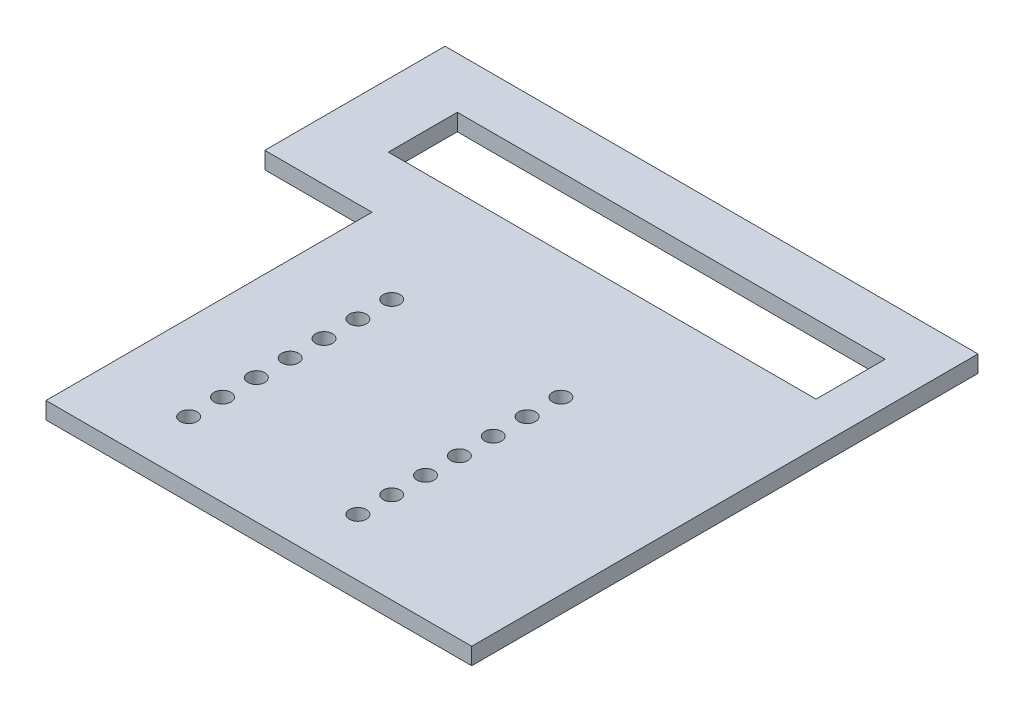
from build123d import *

# Parameters (mm, degrees)
BOSS_EXTRUDE1_DEPTH = 3.175
SKETCH2_R           = 1.5875
SKETCH2_W           = 80.264
SKETCH2_H           = 12.954
CUT_EXTRUDE1_DEPTH  = 223.985606318
SKETCH7_R           = 2.032
SKETCH7_R_2         = 1.651
SKETCH7_W           = 47.244
SKETCH7_H           = 139.192
CUT_EXTRUDE4_DEPTH  = 223.985606318
SKETCH8_R           = 1.651
CUT_EXTRUDE5_DEPTH  = 223.985606318
SKETCH9_R           = 1.778
CUT_EXTRUDE6_DEPTH  = 221.482742149
CUT_EXTRUDE7_DEPTH  = 221.482742149


with BuildPart() as part:
    # Sketch1 → Boss-Extrude1 (new body)
    with BuildSketch(Plane(origin=(0, 0, 0), x_dir=(1, 0, 0), z_dir=(0, 1, 0))):
        with BuildLine():
            Line((-80, 112.5), (100, 112.5))
            Line((100, 112.5), (100, -112.5))
            Line((100, -112.5), (-80, -112.5))
            ThreePointArc((-80, -112.5), (-192.5, 0), (-80, 112.5))
        make_face()
    extrude(amount=-BOSS_EXTRUDE1_DEPTH)

    # Sketch2 → Cut-Extrude1 (cut, through all)
    with BuildSketch(Plane(origin=(0, 0, 0), x_dir=(1, 0, 0), z_dir=(0, 1, 0))):
        with Locations(Location((36.144045702, -66.3448, 0), (0, 0, 270))):
            Circle(SKETCH2_R)
        with Locations(Location((36.144045702, -59.9948, 0), (0, 0, 270))):
            Circle(SKETCH2_R)
        with Locations(Location((36.144045702, -53.6448, 0), (0, 0, 270))):
            Circle(SKETCH2_R)
        with Locations(Location((36.144045702, -47.2948, 0), (0, 0, 270))):
            Circle(SKETCH2_R)
        with Locations(Location((36.144045702, -40.9448, 0), (0, 0, 270))):
            Circle(SKETCH2_R)
        with Locations(Location((36.144045702, -34.5948, 0), (0, 0, 270))):
            Circle(SKETCH2_R)
        with Locations(Location((36.144045702, -28.2448, 0), (0, 0, 270))):
            Circle(SKETCH2_R)
        with Locations(Location((67.894045702, -66.3448, 0), (0, 0, 270))):
            Circle(SKETCH2_R)
        with Locations(Location((67.894045702, -59.9948, 0), (0, 0, 270))):
            Circle(SKETCH2_R)
        with Locations(Location((67.894045702, -53.6448, 0), (0, 0, 270))):
            Circle(SKETCH2_R)
        with Locations(Location((67.894045702, -47.2948, 0), (0, 0, 270))):
            Circle(SKETCH2_R)
        with Locations(Location((67.894045702, -40.9448, 0), (0, 0, 270))):
            Circle(SKETCH2_R)
        with Locations(Location((67.894045702, -34.5948, 0), (0, 0, 270))):
            Circle(SKETCH2_R)
        with Locations(Location((67.894045702, -28.2448, 0), (0, 0, 270))):
            Circle(SKETCH2_R)
        with Locations(Location((36.144045702, 66.3448, 0), (0, 0, 270))):
            Circle(SKETCH2_R)
        with Locations(Location((36.144045702, 59.9948, 0), (0, 0, 270))):
            Circle(SKETCH2_R)
        with Locations(Location((36.144045702, 53.6448, 0), (0, 0, 270))):
            Circle(SKETCH2_R)
        with Locations(Location((36.144045702, 47.2948, 0), (0, 0, 270))):
            Circle(SKETCH2_R)
        with Locations(Location((36.144045702, 40.9448, 0), (0, 0, 270))):
            Circle(SKETCH2_R)
        with Locations(Location((36.144045702, 34.5948, 0), (0, 0, 270))):
            Circle(SKETCH2_R)
        with Locations(Location((36.144045702, 28.2448, 0), (0, 0, 270))):
            Circle(SKETCH2_R)
        with Locations(Location((67.894045702, 66.3448, 0), (0, 0, 270))):
            Circle(SKETCH2_R)
        with Locations(Location((67.894045702, 59.9948, 0), (0, 0, 270))):
            Circle(SKETCH2_R)
        with Locations(Location((67.894045702, 53.6448, 0), (0, 0, 270))):
            Circle(SKETCH2_R)
        with Locations(Location((67.894045702, 47.2948, 0), (0, 0, 270))):
            Circle(SKETCH2_R)
        with Locations(Location((67.894045702, 40.9448, 0), (0, 0, 270))):
            Circle(SKETCH2_R)
        with Locations(Location((67.894045702, 34.5948, 0), (0, 0, 270))):
            Circle(SKETCH2_R)
        with Locations(Location((67.894045702, 28.2448, 0), (0, 0, 270))):
            Circle(SKETCH2_R)
        with Locations((52.019045702, -96.4438)):
            Rectangle(SKETCH2_W, SKETCH2_H)
        with Locations((52.019045702, 96.4438)):
            Rectangle(SKETCH2_W, SKETCH2_H)
    extrude(amount=-CUT_EXTRUDE1_DEPTH, mode=Mode.SUBTRACT)

    # Sketch7 → Cut-Extrude4 (cut, through all)
    with BuildSketch(Plane(origin=(0, 0, 0), x_dir=(1, 0, 0), z_dir=(0, 1, 0))):
        with Locations(Location((-50.421540267, 0, 0), (0, 0, 270))):
            Circle(SKETCH7_R)
        with Locations(Location((25.778459733, 0, 0), (0, 0, 270))):
            Circle(SKETCH7_R_2)
        with Locations(Location((86.738459733, 0, 0), (0, 0, 270))):
            Circle(SKETCH7_R_2)
        with Locations(Location((-50.421540267, 40.64, 0), (0, 0, 270))):
            Circle(SKETCH7_R_2)
        with Locations(Location((-50.421540267, -40.64, 0), (0, 0, 270))):
            Circle(SKETCH7_R_2)
        with Locations(Location((15.872459733, -40.64, 0), (0, 0, 270))):
            Circle(SKETCH7_R)
        with Locations(Location((15.872459733, 40.64, 0), (0, 0, 270))):
            Circle(SKETCH7_R)
        with Locations((-14.099540267, 0)):
            Rectangle(SKETCH7_W, SKETCH7_H)
    extrude(amount=-CUT_EXTRUDE4_DEPTH, mode=Mode.SUBTRACT)

    # Sketch8 → Cut-Extrude5 (cut, through all)
    with BuildSketch(Plane(origin=(0, 0, 0), x_dir=(1, 0, 0), z_dir=(0, 1, 0))):
        with Locations(Location((-177.3836, 33.02, 0), (0, 0, 270))):
            Circle(SKETCH8_R)
        with Locations(Location((-177.3836, -33.02, 0), (0, 0, 270))):
            Circle(SKETCH8_R)
        with Locations(Location((-151.9836, 33.02, 0), (0, 0, 270))):
            Circle(SKETCH8_R)
        with Locations(Location((-151.9836, -33.02, 0), (0, 0, 270))):
            Circle(SKETCH8_R)
        with BuildLine():
            Line((-167.0966, 25.4), (-229.776686608, 25.4))
            Line((-229.776686608, 25.4), (-229.776686608, -25.4))
            Line((-229.776686608, -25.4), (-167.0966, -25.4))
            ThreePointArc((-167.0966, -25.4), (-141.6966, 0), (-167.0966, 25.4))
        make_face()
    extrude(amount=-CUT_EXTRUDE5_DEPTH, mode=Mode.SUBTRACT)

    # Sketch9 → Cut-Extrude6 (cut, through all)
    with BuildSketch(Plane(origin=(0, 0, 0), x_dir=(1, 0, 0), z_dir=(0, 1, 0))):
        with Locations(Location((-161.795319669, -55.88, 0), (0, 0, 270))):
            Circle(SKETCH9_R)
        with Locations(Location((-124.964619687, -86.784626771, 0), (0, 0, 270))):
            Circle(SKETCH9_R)
        with Locations(Location((-161.795319669, 55.88, 0), (0, 0, 270))):
            Circle(SKETCH9_R)
        with Locations(Location((-124.964619687, 86.784626771, 0), (0, 0, 270))):
            Circle(SKETCH9_R)
    extrude(amount=-CUT_EXTRUDE6_DEPTH, mode=Mode.SUBTRACT)

    # Sketch10 → Cut-Extrude7 (cut, through all)
    with BuildSketch(Plane(origin=(0, 0, 0), x_dir=(1, 0, 0), z_dir=(0, 1, 0))):
        Polygon((0, 127.979520785), (0, 78.672810993), (20.125086798, 78.672810993), (20.125086798, 17.499658407), (114.992352539, 17.499658407), (114.992352539, -151.143860627), (-214.259658065, -151.143860627), (-214.259658065, 127.979520785), align=None)
    extrude(amount=-CUT_EXTRUDE7_DEPTH, mode=Mode.SUBTRACT)


solid = part.part
